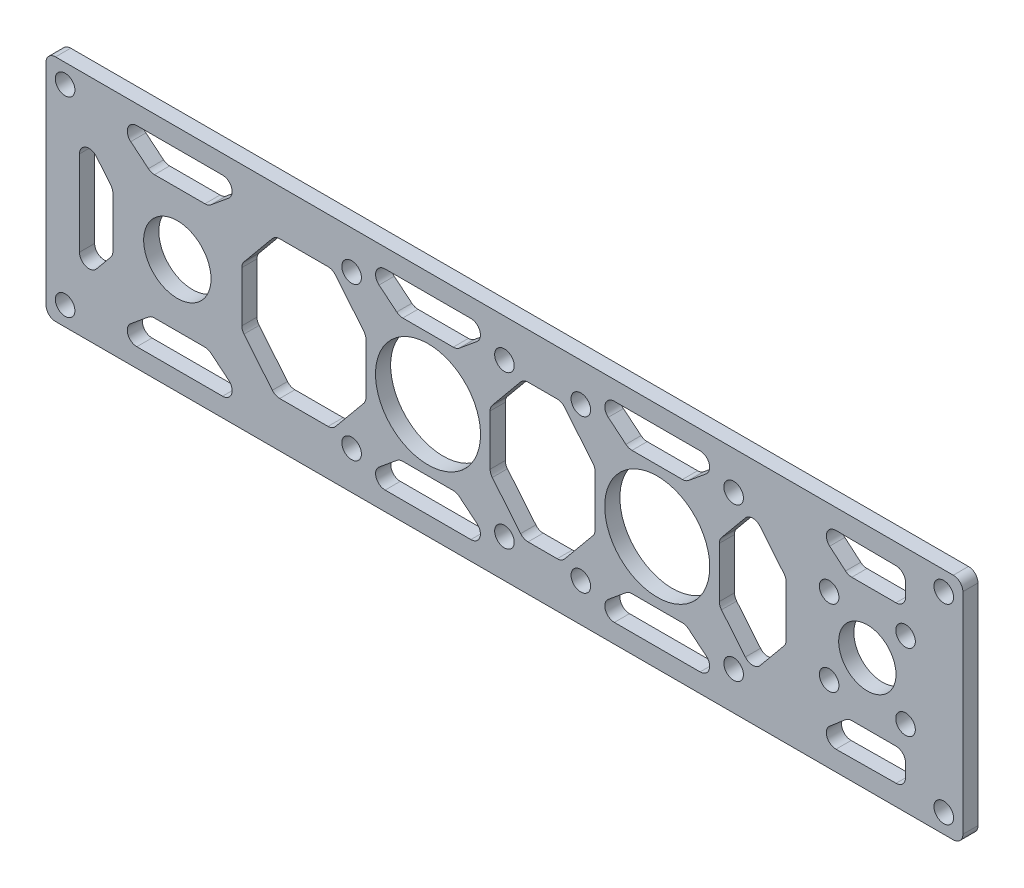
from build123d import *

# Parameters (mm, degrees)
SKETCH1_R           = 2.05
SKETCH1_R_2         = 11
SKETCH1_R_3         = 6
SKETCH1_R_4         = 7.05
BOSS_EXTRUDE1_DEPTH = 3.175
FILLET1_R           = 2


with BuildPart() as part:
    # Sketch1 → Boss-Extrude1 (new body)
    with BuildSketch(Plane.XY):
        Polygon((88, -24), (88, 24), (48, 24), (-104, 24), (-104, -24), align=None)
        with Locations((-100, -20)):
            Circle(SKETCH1_R, mode=Mode.SUBTRACT)
        with Locations((-8, -16)):
            Circle(SKETCH1_R, mode=Mode.SUBTRACT)
        with Locations((8, -16)):
            Circle(SKETCH1_R, mode=Mode.SUBTRACT)
        Polygon((18, -13), (30, -13), (38.544929421, -20.05), (9.455070579, -20.05), align=None, mode=Mode.SUBTRACT)
        with Locations((84, -20)):
            Circle(SKETCH1_R, mode=Mode.SUBTRACT)
        with Locations((40, -16)):
            Circle(SKETCH1_R, mode=Mode.SUBTRACT)
        Polygon((55.939349424, -19.890566499), (64, -13), (76, -13), (76, -19.706694904), align=None, mode=Mode.SUBTRACT)
        with Locations((60, -8)):
            Circle(SKETCH1_R, mode=Mode.SUBTRACT)
        with Locations((76, -8)):
            Circle(SKETCH1_R, mode=Mode.SUBTRACT)
        Polygon((-38.544929421, 20.05), (-9.455070579, 20.05), (-18, 13), (-30, 13), align=None, mode=Mode.SUBTRACT)
        Polygon((-61.455070579, 20.05), (-70, 13), (-82, 13), (-90.544929421, 20.05), align=None, mode=Mode.SUBTRACT)
        Polygon((-96.991160633, 14.484327085), (-89.991160633, 6), (-89.991160633, -6), (-96.991160633, -14.484327085), align=None, mode=Mode.SUBTRACT)
        Polygon((-90.544929421, -20.05), (-82, -13), (-70, -13), (-61.455070579, -20.05), align=None, mode=Mode.SUBTRACT)
        Polygon((-38.544929421, -20.05), (-30, -13), (-18, -13), (-9.455070579, -20.05), align=None, mode=Mode.SUBTRACT)
        Polygon((-4, -14.484327085), (-11, -6), (-11, 6), (-4, 14.484327085), (4, 14.484327085), (11, 6), (11, -6), (4, -14.484327085), align=None, mode=Mode.SUBTRACT)
        with Locations((-100, 20)):
            Circle(SKETCH1_R, mode=Mode.SUBTRACT)
        with Locations((24, 0)):
            Circle(SKETCH1_R_2, mode=Mode.SUBTRACT)
        Polygon((44, 14.484327085), (48, 9.636140179), (51, 6), (51, -6), (44, -14.484327085), (37, -6), (37, 6), align=None, mode=Mode.SUBTRACT)
        with Locations((68, 0)):
            Circle(SKETCH1_R_3, mode=Mode.SUBTRACT)
        with Locations((60, 8)):
            Circle(SKETCH1_R, mode=Mode.SUBTRACT)
        with Locations((76, 8)):
            Circle(SKETCH1_R, mode=Mode.SUBTRACT)
        with Locations((-8, 16)):
            Circle(SKETCH1_R, mode=Mode.SUBTRACT)
        with Locations((8, 16)):
            Circle(SKETCH1_R, mode=Mode.SUBTRACT)
        Polygon((30, 13), (18, 13), (9.455070579, 20.05), (38.544929421, 20.05), align=None, mode=Mode.SUBTRACT)
        with Locations((40, 16)):
            Circle(SKETCH1_R, mode=Mode.SUBTRACT)
        Polygon((64, 13), (55.939349424, 19.890566499), (76, 19.706694904), (76, 13), align=None, mode=Mode.SUBTRACT)
        with Locations((84, 20)):
            Circle(SKETCH1_R, mode=Mode.SUBTRACT)
        Polygon((-63, 6), (-56, 14.484327085), (-44, 14.484327085), (-37, 6), (-37, -6), (-44, -14.484327085), (-56, -14.484327085), (-63, -6), align=None, mode=Mode.SUBTRACT)
        with Locations((-24, 0)):
            Circle(SKETCH1_R_2, mode=Mode.SUBTRACT)
        with Locations((-40, 16)):
            Circle(SKETCH1_R, mode=Mode.SUBTRACT)
        with Locations((-40, -16)):
            Circle(SKETCH1_R, mode=Mode.SUBTRACT)
        with Locations((-76.495580316, 0)):
            Circle(SKETCH1_R_4, mode=Mode.SUBTRACT)
    extrude(amount=BOSS_EXTRUDE1_DEPTH)

    # Fillet1
    fillet1_edges = [part.edges().sort_by_distance(p)[0] for p in [
        (-44, -14.484327085, 1.5875),
        (-37, -6, 1.5875),
        (-37, 6, 1.5875),
        (-44, 14.484327085, 1.5875),
        (-56, 14.484327085, 1.5875),
        (-63, 6, 1.5875),
        (-63, -6, 1.5875),
        (-56, -14.484327085, 1.5875),
        (76, -19.706694904, 1.5875),
        (76, -13, 1.5875),
        (64, -13, 1.5875),
        (55.939349424, -19.890566499, 1.5875),
        (51, 6, 1.5875),
        (44, 14.484327085, 1.5875),
        (37, 6, 1.5875),
        (37, -6, 1.5875),
        (44, -14.484327085, 1.5875),
        (51, -6, 1.5875),
        (18, 13, 1.5875),
        (30, 13, 1.5875),
        (38.544929421, 20.05, 1.5875),
        (9.455070579, 20.05, 1.5875),
        (9.455070579, -20.05, 1.5875),
        (38.544929421, -20.05, 1.5875),
        (30, -13, 1.5875),
        (18, -13, 1.5875),
        (64, 13, 1.5875),
        (76, 13, 1.5875),
        (76, 19.706694904, 1.5875),
        (55.939349424, 19.890566499, 1.5875),
        (-82, -13, 1.5875),
        (-90.544929421, -20.05, 1.5875),
        (-61.455070579, -20.05, 1.5875),
        (-70, -13, 1.5875),
        (88, -24, 1.5875),
        (-104, -24, 1.5875),
        (-104, 24, 1.5875),
        (88, 24, 1.5875),
        (-61.455070579, 20.05, 1.5875),
        (-90.544929421, 20.05, 1.5875),
        (-82, 13, 1.5875),
        (-70, 13, 1.5875),
        (-30, -13, 1.5875),
        (-38.544929421, -20.05, 1.5875),
        (-9.455070579, -20.05, 1.5875),
        (-18, -13, 1.5875),
        (-11, -6, 1.5875),
        (-4, -14.484327085, 1.5875),
        (4, -14.484327085, 1.5875),
        (11, -6, 1.5875),
        (11, 6, 1.5875),
        (4, 14.484327085, 1.5875),
        (-4, 14.484327085, 1.5875),
        (-11, 6, 1.5875),
        (-18, 13, 1.5875),
        (-9.455070579, 20.05, 1.5875),
        (-38.544929421, 20.05, 1.5875),
        (-30, 13, 1.5875),
        (-96.991160633, 14.484327085, 1.5875),
        (-96.991160633, -14.484327085, 1.5875),
        (-89.991160633, -6, 1.5875),
        (-89.991160633, 6, 1.5875),
    ]]
    fillet(fillet1_edges, radius=FILLET1_R)


solid = part.part
